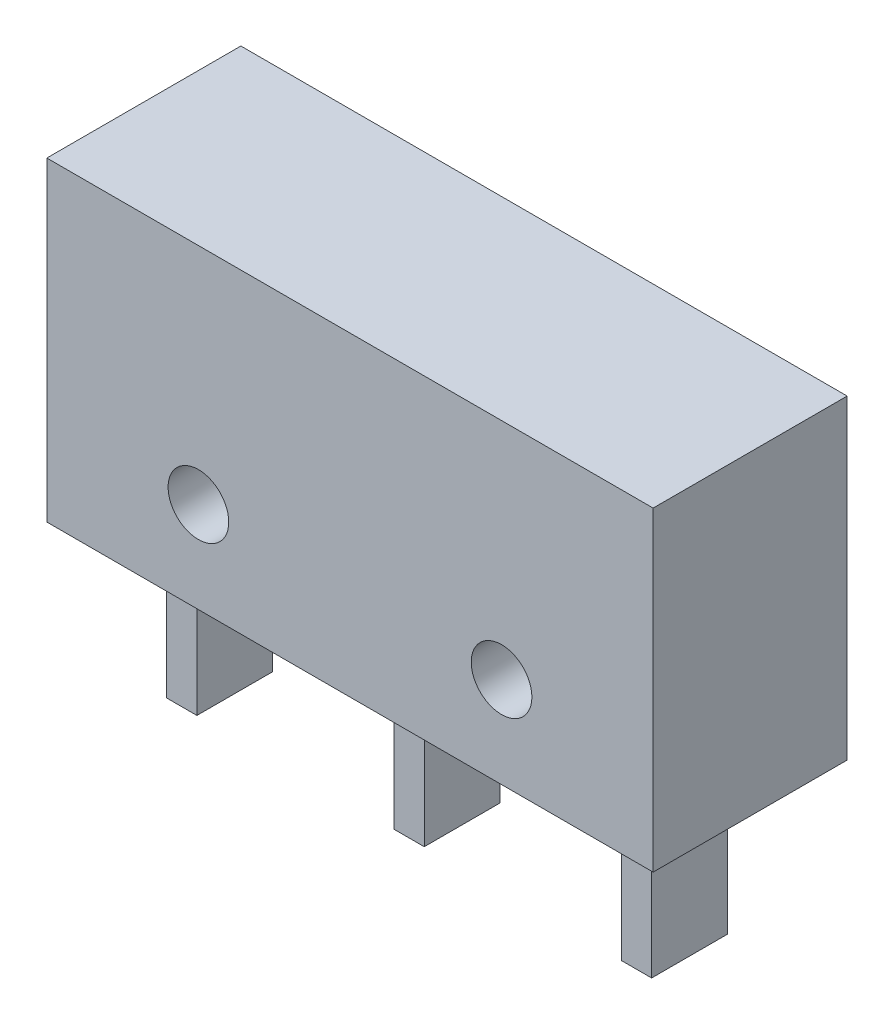
from build123d import *

# Parameters (mm, degrees)
ESQUISSE1_W        = 20
ESQUISSE1_H        = 10.4
ESQUISSE1_R        = 1
BOSS_EXTRU_1_DEPTH = 6.4
ESQUISSE2_W        = 1
ESQUISSE2_H        = 2.5
BOSS_EXTRU_2_DEPTH = 5


with BuildPart() as part:
    # Esquisse1 → Boss.-Extru.1 (new body)
    with BuildSketch(Plane.XY):
        Rectangle(ESQUISSE1_W, ESQUISSE1_H)
        with Locations((-5, -2.2)):
            Circle(ESQUISSE1_R, mode=Mode.SUBTRACT)
        with Locations((5, -2.2)):
            Circle(ESQUISSE1_R, mode=Mode.SUBTRACT)
    extrude(amount=BOSS_EXTRU_1_DEPTH)

    # Esquisse2 → Boss.-Extru.2 (add)
    with BuildSketch(Plane.XZ.offset(5.2)):
        with Locations((-7.5, 3.2)):
            Rectangle(ESQUISSE2_W, ESQUISSE2_H)
        with Locations((0, 3.2)):
            Rectangle(ESQUISSE2_W, ESQUISSE2_H)
        with Locations((7.5, 3.2)):
            Rectangle(ESQUISSE2_W, ESQUISSE2_H)
    extrude(amount=BOSS_EXTRU_2_DEPTH)


solid = part.part
